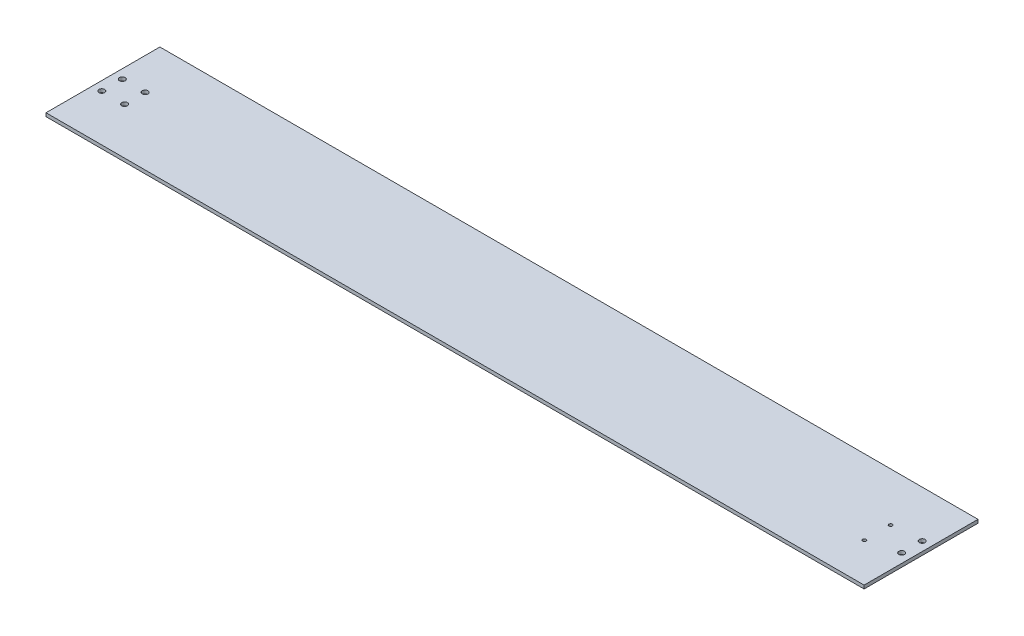
from build123d import *

# Parameters (mm, degrees)
SKETCH1_W           = 718.32
SKETCH1_H           = 100
BOSS_EXTRUDE1_DEPTH = 3
SKETCH2_R           = 2.5
CUT_EXTRUDE1_DEPTH  = 30
SKETCH3_R           = 2.5
CUT_EXTRUDE2_DEPTH  = 30
SKETCH4_R           = 1.5
CUT_EXTRUDE3_DEPTH  = 10


with BuildPart() as part:
    # Sketch1 → Boss-Extrude1 (new body)
    with BuildSketch(Plane(origin=(0, 0, 0), x_dir=(1, 0, 0), z_dir=(0, 1, 0))):
        with Locations((-359.16, 50)):
            Rectangle(SKETCH1_W, SKETCH1_H)
    extrude(amount=BOSS_EXTRUDE1_DEPTH)

    # Sketch2 → Cut-Extrude1 (cut)
    with BuildSketch(Plane(origin=(0, 3, 0), x_dir=(1, 0, 0), z_dir=(0, 1, 0))):
        with Locations(Location((-710.32, 59, 0), (0, 0, 270))):
            Circle(SKETCH2_R)
        with Locations(Location((-8, 59, 0), (0, 0, 270))):
            Circle(SKETCH2_R)
        with Locations(Location((-8, 41, 0), (0, 0, 270))):
            Circle(SKETCH2_R)
        with Locations(Location((-710.32, 41, 0), (0, 0, 270))):
            Circle(SKETCH2_R)
    extrude(amount=-CUT_EXTRUDE1_DEPTH, mode=Mode.SUBTRACT)

    # Sketch3 → Cut-Extrude2 (cut)
    with BuildSketch(Plane(origin=(0, 3, 0), x_dir=(1, 0, 0), z_dir=(0, 1, 0))):
        with Locations(Location((-690.32, 59, 0), (0, 0, 270))):
            Circle(SKETCH3_R)
        with Locations(Location((-690.32, 41, 0), (0, 0, 270))):
            Circle(SKETCH3_R)
    extrude(amount=-CUT_EXTRUDE2_DEPTH, mode=Mode.SUBTRACT)

    # Sketch4 → Cut-Extrude3 (cut)
    with BuildSketch(Plane(origin=(0, 3, 0), x_dir=(1, 0, 0), z_dir=(0, 1, 0))):
        with Locations(Location((-34, 57.27680918, 0), (0, 0, 270))):
            Circle(SKETCH4_R)
        with Locations(Location((-34, 34.27680918, 0), (0, 0, 270))):
            Circle(SKETCH4_R)
    extrude(amount=-CUT_EXTRUDE3_DEPTH, mode=Mode.SUBTRACT)


solid = part.part
